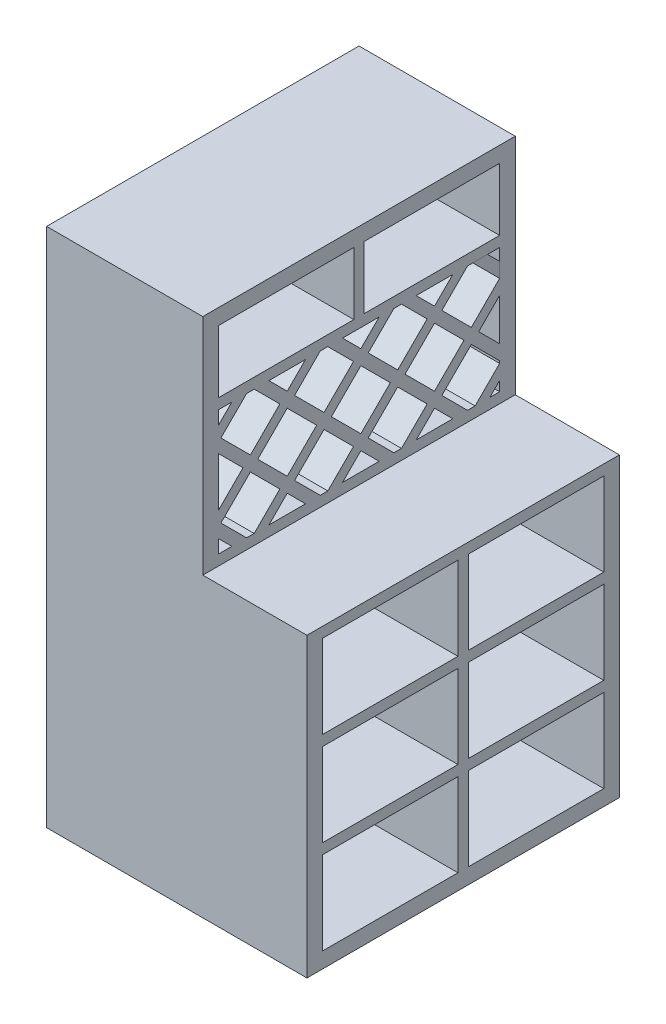
from build123d import *

# Parameters (mm, degrees)
BOSS_EXTRUDE1_DEPTH = 30
SKETCH2_W           = 26
SKETCH2_H           = 16
CUT_EXTRUDE1_DEPTH  = 83.543040987
SKETCH3_W           = 26
SKETCH3_H           = 12
CUT_EXTRUDE2_DEPTH  = 73.203556805
CUT_EXTRUDE3_DEPTH  = 73.203556805
BOSS_EXTRUDE2_DEPTH = 30


with BuildPart() as part:
    # Sketch1 → Boss-Extrude1 (new, symmetric)
    with BuildSketch(Plane.XY):
        Polygon((-25, 58.423913043), (-25, -41.576086957), (25, -41.576086957), (25, 15.423913043), (5, 15.423913043), (5, 58.423913043), align=None)
    extrude(amount=BOSS_EXTRUDE1_DEPTH, both=True)

    # Sketch2 → Cut-Extrude1 (cut, through all)
    with BuildSketch(Plane(origin=(25, 0, 0), x_dir=(0, 0, -1), z_dir=(1, 0, 0))):
        with Locations((-14, 5.423913043)):
            Rectangle(SKETCH2_W, SKETCH2_H)
        with Locations((14, 5.423913043)):
            Rectangle(SKETCH2_W, SKETCH2_H)
        with Locations((-14, -12.576086957)):
            Rectangle(SKETCH2_W, SKETCH2_H)
        with Locations((14, -12.576086957)):
            Rectangle(SKETCH2_W, SKETCH2_H)
        with Locations((14, -30.576086957)):
            Rectangle(SKETCH2_W, SKETCH2_H)
        with Locations((-14, -30.576086957)):
            Rectangle(SKETCH2_W, SKETCH2_H)
    extrude(amount=-CUT_EXTRUDE1_DEPTH, mode=Mode.SUBTRACT)

    # Sketch3 → Cut-Extrude2 (cut, through all)
    with BuildSketch(Plane(origin=(5, 0, 0), x_dir=(0, 0, -1), z_dir=(1, 0, 0))):
        with Locations((14, 49.423913043)):
            Rectangle(SKETCH3_W, SKETCH3_H)
    cut_extrude2 = extrude(amount=-CUT_EXTRUDE2_DEPTH, mode=Mode.SUBTRACT)

    # Mirror2: Cut-Extrude2 across plane
    add(cut_extrude2.mirror(Plane.XY), mode=Mode.SUBTRACT)

    # Sketch4 → Cut-Extrude3 (cut, through all)
    with BuildSketch(Plane(origin=(5, 0, 0), x_dir=(0, 0, -1), z_dir=(1, 0, 0))):
        Polygon((-27, 41.423913043), (-24.420447792, 41.423913043), (-27, 38.844360836), align=None)
        Polygon((-27, 17.423913043), (-24.420447792, 17.423913043), (-27, 20.003465251), align=None)
        Polygon((27, 41.423913043), (27, 36.275818341), (21.562308265, 30.838126606), (15.905454016, 36.494980855), (20.834386204, 41.423913043), align=None)
        Polygon((-26.520952855, 22.352845232), (-21.592020667, 17.423913043), (-20.136176545, 17.423913043), (-15.207244356, 22.352845232), (-20.864098606, 28.009699481), align=None)
        Polygon((-20.136176545, 41.423913043), (-15.207244356, 36.494980855), (-20.864098606, 30.838126606), (-26.520952855, 36.494980855), (-21.592020667, 41.423913043), align=None)
        Polygon((-17.30774942, 41.423913043), (-13.793030794, 37.909194418), (-10.278312168, 41.423913043), align=None)
        Polygon((-27, 34.145600875), (-22.278312168, 29.423913043), (-27, 24.702225212), align=None)
        Polygon((-5.994040921, 41.423913043), (-1.065108733, 36.494980855), (-6.721962982, 30.838126606), (-12.378817232, 36.494980855), (-7.449885044, 41.423913043), align=None)
        Polygon((-3.165613796, 41.423913043), (0.34910483, 37.909194418), (3.863823455, 41.423913043), align=None)
        Polygon((8.148094703, 41.423913043), (13.077026891, 36.494980855), (7.420172641, 30.838126606), (1.763318392, 36.494980855), (6.69225058, 41.423913043), align=None)
        Polygon((10.976521828, 41.423913043), (14.491240453, 37.909194418), (18.005959079, 41.423913043), align=None)
        Polygon((-5.994040921, 17.423913043), (-1.065108733, 22.352845232), (-6.721962982, 28.009699481), (-12.378817232, 22.352845232), (-7.449885044, 17.423913043), align=None)
        Polygon((-17.30774942, 17.423913043), (-13.793030794, 20.938631669), (-10.278312168, 17.423913043), align=None)
        Polygon((-3.165613796, 17.423913043), (0.34910483, 20.938631669), (3.863823455, 17.423913043), align=None)
        Polygon((8.148094703, 17.423913043), (13.077026891, 22.352845232), (7.420172641, 28.009699481), (1.763318392, 22.352845232), (6.69225058, 17.423913043), align=None)
        Polygon((10.976521828, 17.423913043), (14.491240453, 20.938631669), (18.005959079, 17.423913043), align=None)
        Polygon((25.118657451, 17.423913043), (27, 19.305255592), (27, 17.423913043), align=None)
        Polygon((22.290230327, 17.423913043), (27, 22.133682717), (27, 22.572007746), (21.562308265, 28.009699481), (15.905454016, 22.352845232), (20.834386204, 17.423913043), align=None)
        Polygon((-13.793030794, 35.080767293), (-8.136176545, 29.423913043), (-13.793030794, 23.767058794), (-19.449885044, 29.423913043), align=None)
        Polygon((-5.30774942, 29.423913043), (0.34910483, 23.767058794), (6.005959079, 29.423913043), (0.34910483, 35.080767293), align=None)
        Polygon((22.976521828, 29.423913043), (27, 33.447391216), (27, 25.400434871), align=None)
        Polygon((14.491240453, 35.080767293), (20.148094703, 29.423913043), (14.491240453, 23.767058794), (8.834386204, 29.423913043), align=None)
    extrude(amount=-CUT_EXTRUDE3_DEPTH, mode=Mode.SUBTRACT)


with BuildPart() as body_2:
    # Sketch5 → Boss-Extrude2 (new, through all)
    with BuildSketch(Plane(origin=(5, 0, 0), x_dir=(0, 0, -1), z_dir=(1, 0, 0))):
        Polygon((27, 36.275818341), (21.851905297, 41.423913043), (24.680332422, 41.423913043), (27, 39.104245465), align=None)
    extrude(amount=-BOSS_EXTRUDE2_DEPTH)


solid = Compound([part.part, body_2.part])
